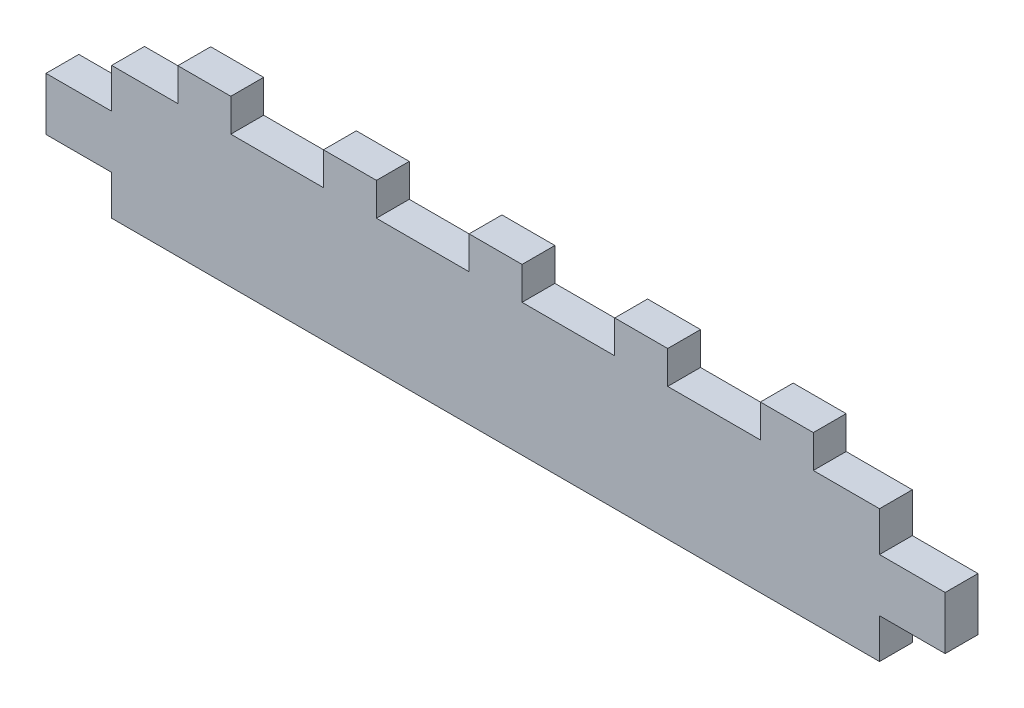
from build123d import *

# Parameters (mm, degrees)
BOSS_EXTRUDE1_DEPTH = 12.4


with BuildPart() as part:
    # Model → Boss-Extrude1 (new body)
    with BuildSketch(Plane.XY):
        Polygon((145, 35), (145, 50), (120, 50), (120, 62.4), (100, 62.4), (100, 50), (65, 50), (65, 62.4), (45, 62.4), (45, 50), (10, 50), (10, 62.4), (-10, 62.4), (-10, 50), (-45, 50), (-45, 62.4), (-65, 62.4), (-65, 50), (-100, 50), (-100, 62.4), (-120, 62.4), (-120, 50), (-145, 50), (-145, 35), (-169.8, 35), (-169.8, 15), (-145, 15), (-145, 0), (145, 0), (145, 15), (169.8, 15), (169.8, 35), align=None)
    extrude(amount=BOSS_EXTRUDE1_DEPTH)


solid = part.part
